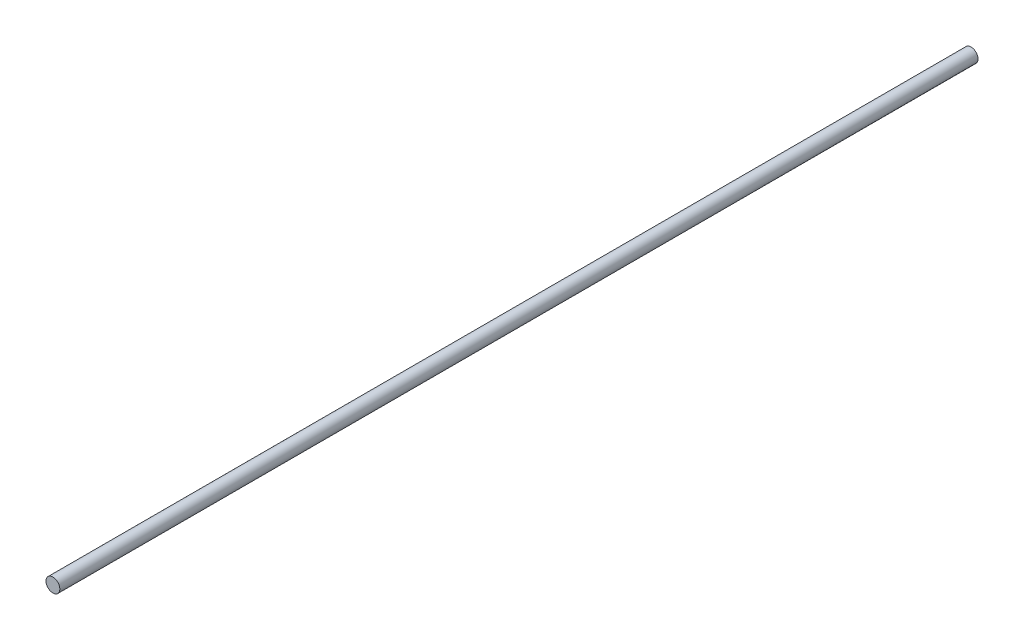
from build123d import *

# Parameters (mm, degrees)
SKETCH1_R           = 4.7625
BOSS_EXTRUDE1_DEPTH = 631.19


with BuildPart() as part:
    # Sketch1 → Boss-Extrude1 (new body)
    with BuildSketch(Plane.XY):
        Circle(SKETCH1_R)
    extrude(amount=BOSS_EXTRUDE1_DEPTH)


solid = part.part
